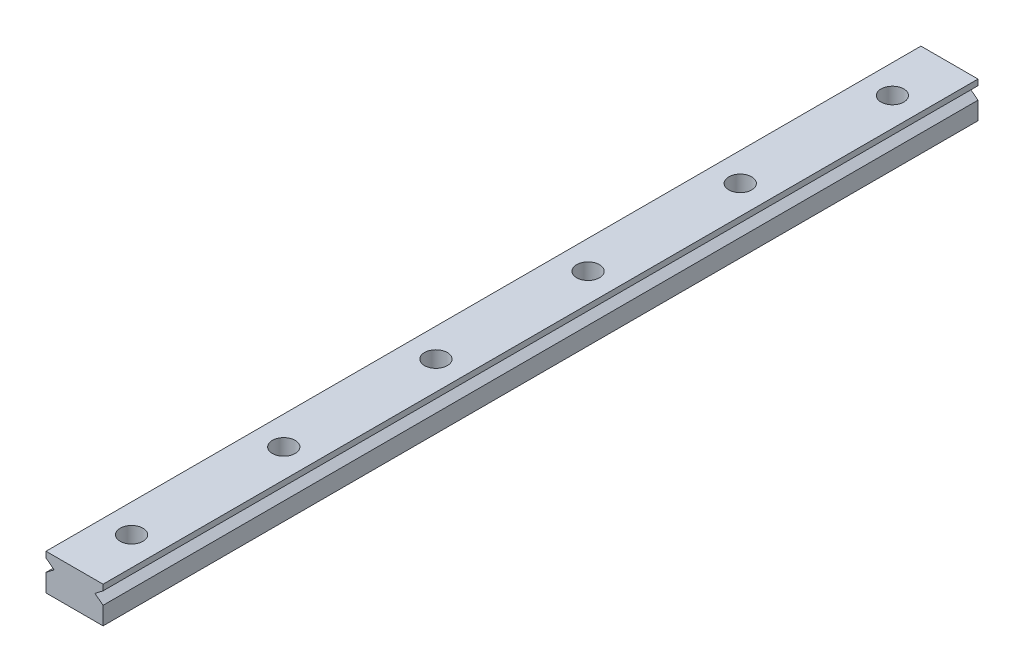
from build123d import *

# Parameters (mm, degrees)
RAIL_DEPTH      = 230
LPATTERN1_COUNT = 6
LPATTERN1_PITCH = 40


with BuildPart() as part:
    # Sketch2 → Rail (new body)
    with BuildSketch(Plane.XY):
        Polygon((-7.5, 0), (7.5, 0), (7.5, 4.689061216), (5.357142857, 6.333333333), (7.5, 7.97760545), (7.5, 9.5), (-7.5, 9.5), (-7.5, 7.97760545), (-5.357142857, 6.333333333), (-7.5, 4.689061216), align=None)
    extrude(amount=-RAIL_DEPTH)

    # Sketch6 → C'Bore (revolve, cut)
    with BuildSketch(Plane(origin=(0, 0, 0), x_dir=(0, 0, -1), z_dir=(1, 0, 0)), mode=Mode.PRIVATE) as c_bore_sk:
        Polygon((215, 9.5), (218, 9.5), (218, 5), (216.75, 5), (216.75, 0), (215, 0), align=None)
    c_bore = revolve(c_bore_sk.sketch.rotate(Axis((0, 8.904905435, -215), (0, -1, 0)), 180), axis=Axis((0, 8.904905435, -215), (0, -1, 0)), mode=Mode.SUBTRACT)

    # LPattern1: C'Bore ×6
    with Locations(*[(0, 0, i * LPATTERN1_PITCH) for i in range(1, LPATTERN1_COUNT)]):
        add(c_bore, mode=Mode.SUBTRACT)


solid = part.part
